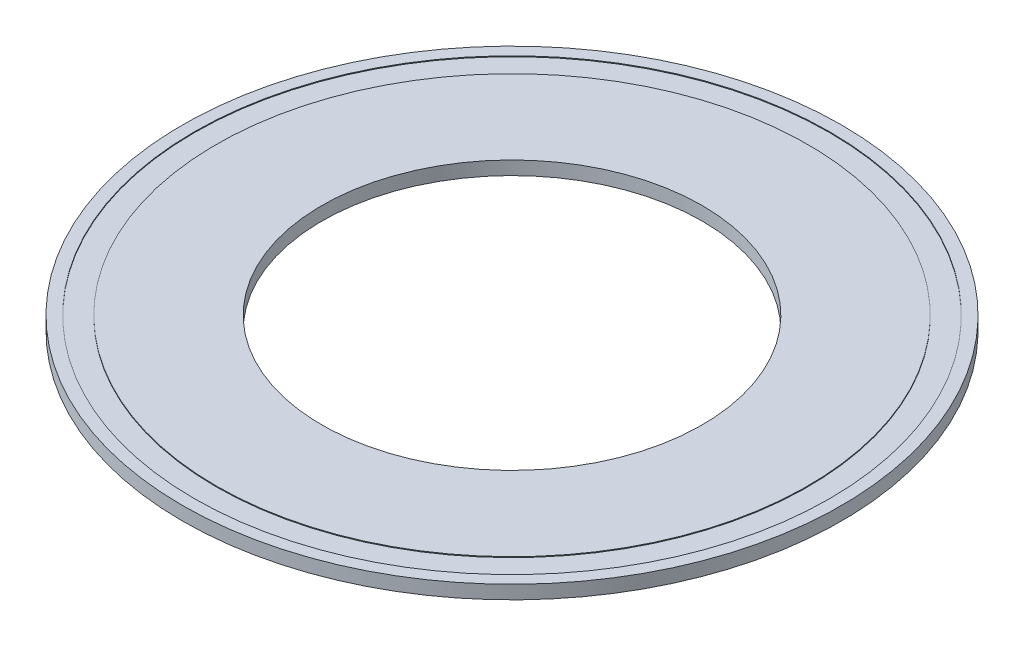
from build123d import *

# Parameters (mm, degrees)
ESQUISSE1_W             = 16.5
ESQUISSE1_H             = 1.6
ESQUISSE2_R             = 37.6
ESQUISSE2_R_2           = 35
ENL_V_MAT_EXTRU_1_DEPTH = 0.1


with BuildPart() as part:
    # Esquisse1 → Révolution1 (revolve)
    with BuildSketch(Plane.XY, mode=Mode.PRIVATE) as r_volution1_sk:
        with Locations((30.75, 0)):
            Rectangle(ESQUISSE1_W, ESQUISSE1_H)
    revolve(r_volution1_sk.sketch.rotate(Axis((0, -15.298646519, 0), (0, 1, 0)), 90), axis=Axis((0, -15.298646519, 0), (0, 1, 0)))

    # Esquisse2 → Enlèv. mat.-Extru.1 (cut)
    with BuildSketch(Plane(origin=(0, 0.8, 0), x_dir=(1, 0, 0), z_dir=(0, 1, 0))):
        with Locations(Location((0, 0, 0), (0, 0, 270))):
            Circle(ESQUISSE2_R)
        with Locations(Location((0, 0, 0), (0, 0, 270))):
            Circle(ESQUISSE2_R_2, mode=Mode.SUBTRACT)
    extrude(amount=-ENL_V_MAT_EXTRU_1_DEPTH, mode=Mode.SUBTRACT)


solid = part.part
